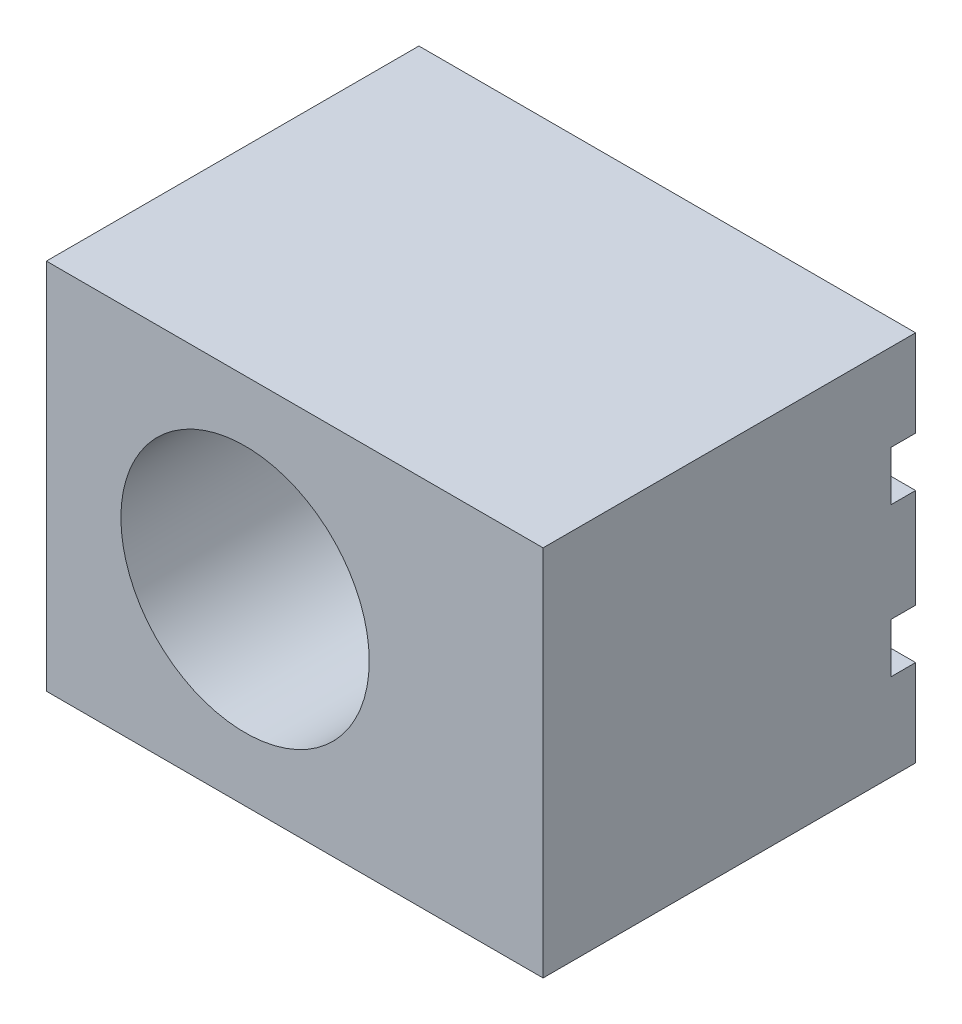
from build123d import *

# Parameters (mm, degrees)
SKETCH1_W           = 7.5
SKETCH1_H           = 10
BOSS_EXTRUDE1_DEPTH = 7.5
SKETCH2_R           = 2.5
CUT_EXTRUDE1_DEPTH  = 7.5
SKETCH3_W           = 10
SKETCH3_H           = 1
CUT_EXTRUDE2_DEPTH  = 0.5


with BuildPart() as part:
    # Sketch1 → Boss-Extrude1 (new body)
    with BuildSketch(Plane(origin=(0, 0, 0), x_dir=(0, 1, 0), z_dir=(0, 0, 1))):
        with Locations((-0.026595745, -0.292553191)):
            Rectangle(SKETCH1_W, SKETCH1_H)
    extrude(amount=BOSS_EXTRUDE1_DEPTH)

    # Sketch2 → Cut-Extrude1 (cut)
    with BuildSketch(Plane.XY.offset(7.5)):
        with Locations((-0.707446809, 0)):
            Circle(SKETCH2_R)
    extrude(amount=-CUT_EXTRUDE1_DEPTH, mode=Mode.SUBTRACT)

    # Sketch3 → Cut-Extrude2 (cut)
    with BuildSketch(Plane(origin=(0, 0, 0), x_dir=(1, 0, 0), z_dir=(0, 0, -1))):
        with Locations((0.292553191, 1.526595745)):
            Rectangle(SKETCH3_W, SKETCH3_H)
        with Locations((0.292553191, -1.473404255)):
            Rectangle(SKETCH3_W, SKETCH3_H)
    extrude(amount=-CUT_EXTRUDE2_DEPTH, mode=Mode.SUBTRACT)


solid = part.part
